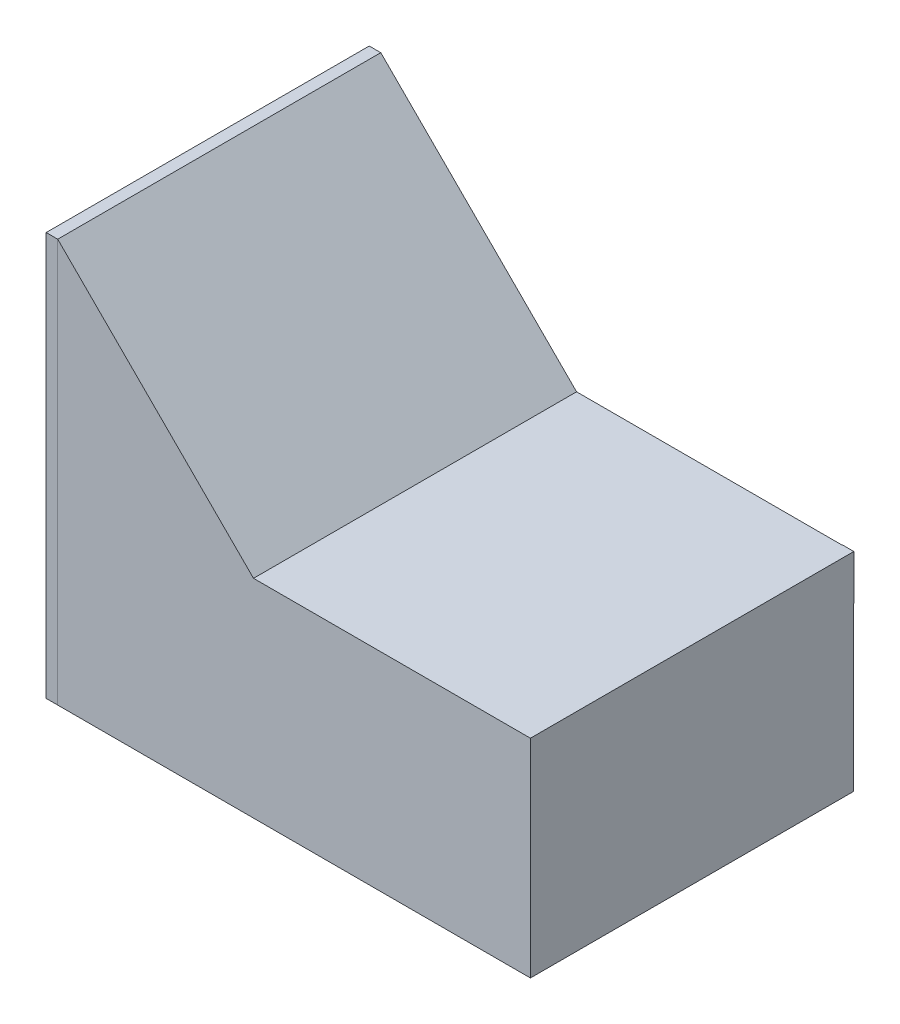
from build123d import *

# Parameters (mm, degrees)
BOSS_EXTRUDE1_DEPTH  = 5
SKETCH2_W            = 120
SKETCH2_H            = 140
BOSS_EXTRUDE2_DEPTH  = 5
SKETCH4_W            = 135
SKETCH4_H            = 120
BOSS_EXTRUDE6_DEPTH  = 5
SKETCH5_W            = 140
SKETCH5_H            = 174.852813742
BOSS_EXTRUDE8_DEPTH  = 5
SKETCH6_W            = 135
SKETCH6_H            = 5
BOSS_EXTRUDE9_DEPTH  = 5
BOSS_EXTRUDE10_DEPTH = 5


with BuildPart() as part:
    # Sketch1 → Boss-Extrude1 (new body)
    with BuildSketch(Plane.XY):
        Polygon((0, 0), (-204.852813742, 0), (-204.852813742, 174.852813742), (-120, 90), (0, 90), align=None)
    boss_extrude1 = extrude(amount=-BOSS_EXTRUDE1_DEPTH)

    # Sketch2 → Boss-Extrude2 (add)
    with BuildSketch(Plane(origin=(0, 90, 0), x_dir=(1, 0, 0), z_dir=(0, 1, 0))):
        with Locations((-60, 70)):
            Rectangle(SKETCH2_W, SKETCH2_H)
    extrude(amount=-BOSS_EXTRUDE2_DEPTH)



with BuildPart() as body_2:
    # Sketch4 → Boss-Extrude6 (new body)
    with BuildSketch(Plane(origin=(-15, -15, 0), x_dir=(0, 0, -1), z_dir=(0.7071067811865483, 0.7071067811865468, 0))):
        with Locations((72.5, 208.492424049)):
            Rectangle(SKETCH4_W, SKETCH4_H)
    extrude(amount=-BOSS_EXTRUDE6_DEPTH)


with BuildPart() as body_3:
    # Sketch5 → Boss-Extrude8 (new body)
    with BuildSketch(Plane.ZY.offset(204.852813742)):
        with Locations((-70, 87.426406871)):
            Rectangle(SKETCH5_W, SKETCH5_H)
    extrude(amount=BOSS_EXTRUDE8_DEPTH)


with BuildPart() as part_1:
    add(part.part)

    add(body_2.part)  # Boss-Extrude9 merges body 2
    # Sketch6 → Boss-Extrude9 (add)
    with BuildSketch(Plane.ZY.offset(120)):
        with Locations((-72.5, 87.5)):
            Rectangle(SKETCH6_W, SKETCH6_H)
    extrude(amount=BOSS_EXTRUDE9_DEPTH)

    # Sketch7 → Boss-Extrude10 (add)
    with BuildSketch(Plane(origin=(0, 0, 0), x_dir=(0, 0, -1), z_dir=(1, 0, 0))):
        Polygon((0, 90), (140.148628639, 90), (140, 0), (0, 0), align=None)
    extrude(amount=-BOSS_EXTRUDE10_DEPTH)

    # Mirror1: Boss-Extrude1 across plane
    add(boss_extrude1.mirror(Plane.XY.offset(-70)))


solid = Compound([body_3.part, part_1.part])
